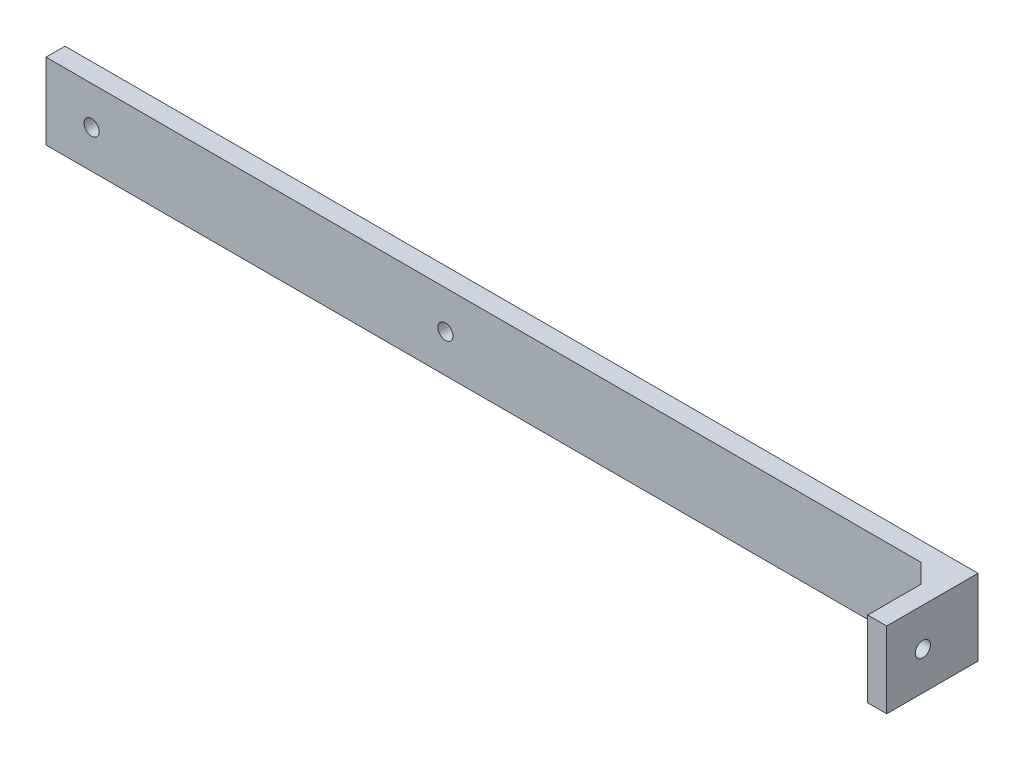
from build123d import *

# Parameters (mm, degrees)
SKETCH1_W           = 240
SKETCH1_H           = 20
BOSS_EXTRUDE1_DEPTH = 5
SKETCH2_W           = 5
SKETCH2_H           = 20
BOSS_EXTRUDE2_DEPTH = 19
SKETCH3_R           = 2
CUT_EXTRUDE1_DEPTH  = 242.404225315
SKETCH4_W           = 5
SKETCH4_H           = 5
BOSS_EXTRUDE3_DEPTH = 5
CUT_EXTRUDE2_DEPTH  = 125
SKETCH6_R           = 2
CUT_EXTRUDE3_DEPTH  = 123.784363825
SKETCH7_R           = 2
CUT_EXTRUDE4_DEPTH  = 10


with BuildPart() as part:
    # Sketch1 → Boss-Extrude1 (new body)
    with BuildSketch(Plane.XY):
        Rectangle(SKETCH1_W, SKETCH1_H)
    extrude(amount=BOSS_EXTRUDE1_DEPTH)

    # Sketch2 → Boss-Extrude2 (add)
    with BuildSketch(Plane.XY.offset(5)):
        with Locations((117.5, 0)):
            Rectangle(SKETCH2_W, SKETCH2_H)
    extrude(amount=BOSS_EXTRUDE2_DEPTH)

    # Sketch3 → Cut-Extrude1 (cut, through all)
    with BuildSketch(Plane(origin=(120, 0, 0), x_dir=(0, 0, -1), z_dir=(1, 0, 0))):
        with Locations((-14.5, 0)):
            Circle(SKETCH3_R)
    extrude(amount=-CUT_EXTRUDE1_DEPTH, mode=Mode.SUBTRACT)

    # Sketch4 → Boss-Extrude3 (add)
    with BuildSketch(Plane.ZY.offset(-115)):
        with Locations((7.5, -7.5)):
            Rectangle(SKETCH4_W, SKETCH4_H)
        with Locations((7.5, 7.5)):
            Rectangle(SKETCH4_W, SKETCH4_H)
    extrude(amount=BOSS_EXTRUDE3_DEPTH)

    # Sketch5 → Cut-Extrude2 (cut, through all)
    with BuildSketch(Plane.XZ.offset(10)):
        Polygon((110, 5), (115, 10), (110, 10), align=None)
    extrude(amount=-CUT_EXTRUDE2_DEPTH, mode=Mode.SUBTRACT)

    # Sketch6 → Cut-Extrude3 (cut, through all)
    with BuildSketch(Plane(origin=(0, 0, 0), x_dir=(-1, 0, 0), z_dir=(0, 0, -1))):
        with Locations((108, 0)):
            Circle(SKETCH6_R)
    extrude(amount=-CUT_EXTRUDE3_DEPTH, mode=Mode.SUBTRACT)

    # Sketch7 → Cut-Extrude4 (cut)
    with BuildSketch(Plane(origin=(0, 0, 0), x_dir=(-1, 0, 0), z_dir=(0, 0, -1))):
        with Locations((15, 0)):
            Circle(SKETCH7_R)
    extrude(amount=-CUT_EXTRUDE4_DEPTH, mode=Mode.SUBTRACT)


solid = part.part
